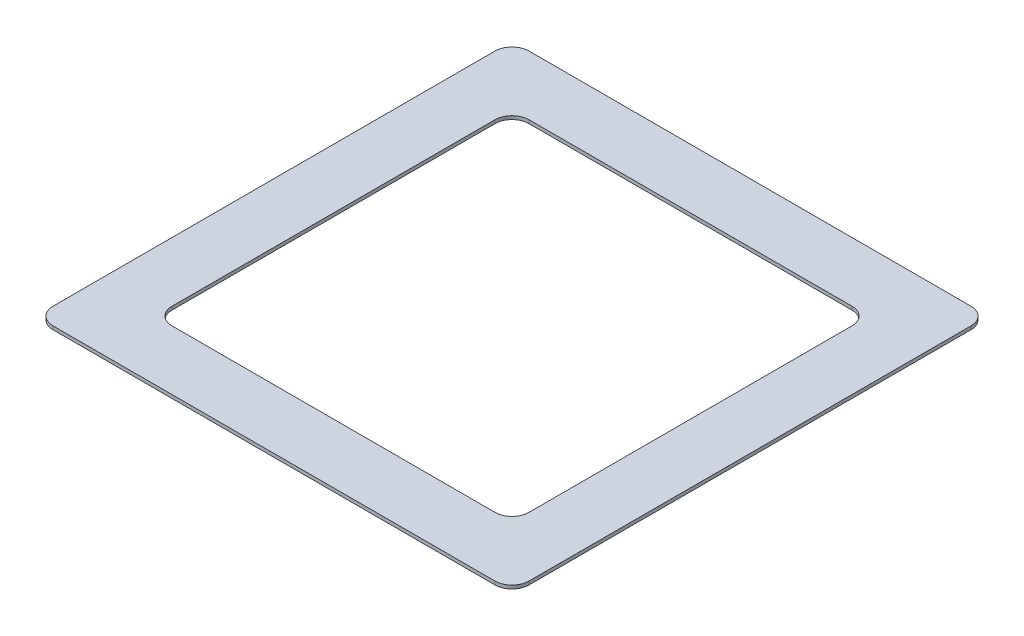
from build123d import *

# Parameters (mm, degrees)
EXTRUDE_1_DEPTH = 2


with BuildPart() as part:
    # 草图1 → 凸台-拉伸1 (new body)
    with BuildSketch(Plane(origin=(0, 0, 0), x_dir=(1, 0, 0), z_dir=(0, 1, 0))):
        with BuildLine():
            Line((10, 0), (270, 0))
            ThreePointArc((270, 0), (277.071067812, -2.928932188), (280, -10))
            Line((280, -10), (280, -270))
            ThreePointArc((280, -270), (277.071067812, -277.071067812), (270, -280))
            Line((270, -280), (10, -280))
            ThreePointArc((10, -280), (2.928932188, -277.071067812), (0, -270))
            Line((0, -270), (0, -10))
            ThreePointArc((0, -10), (2.928932188, -2.928932188), (10, 0))
        make_face()
        with BuildLine():
            Line((45, -35), (235, -35))
            ThreePointArc((235, -35), (242.071067812, -37.928932188), (245, -45))
            Line((245, -45), (245, -235))
            ThreePointArc((245, -235), (242.071067812, -242.071067812), (235, -245))
            Line((235, -245), (45, -245))
            ThreePointArc((45, -245), (37.928932188, -242.071067812), (35, -235))
            Line((35, -235), (35, -45))
            ThreePointArc((35, -45), (37.928932188, -37.928932188), (45, -35))
        make_face(mode=Mode.SUBTRACT)
    extrude(amount=EXTRUDE_1_DEPTH)


solid = part.part
